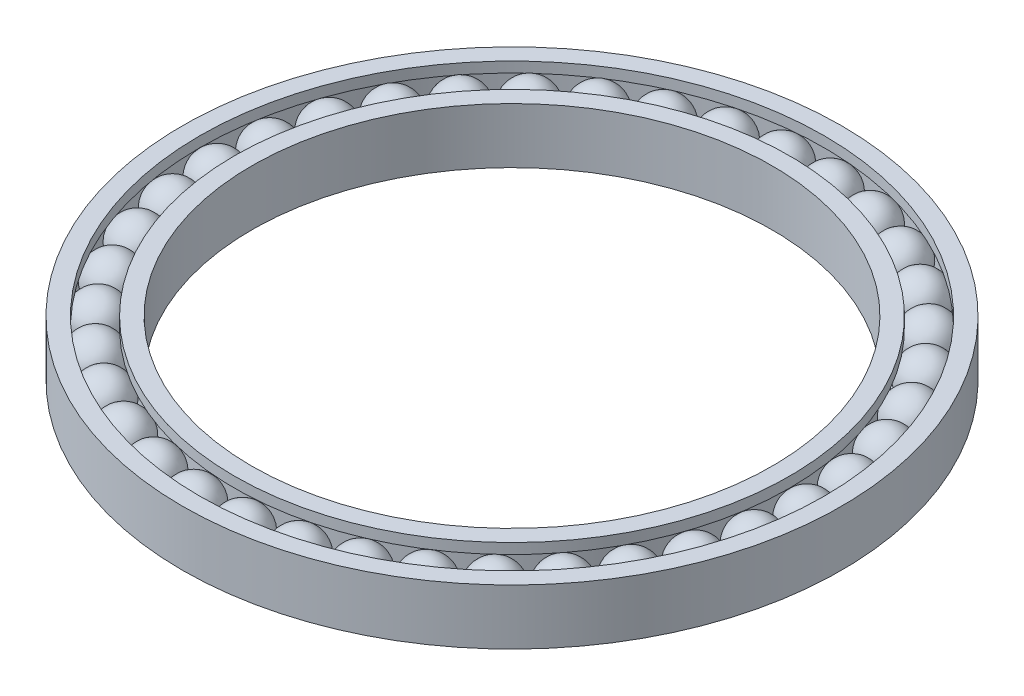
from build123d import *

# Parameters (mm, degrees)
BOSS_EXTRUDE1_START = 3
SKETCH2_R           = 47.5
SKETCH2_R_2         = 45
BOSS_EXTRUDE1_DEPTH = 8
BOSS_EXTRUDE2_START = 3
SKETCH5_R           = 40
SKETCH5_R_2         = 37.5
BOSS_EXTRUDE2_DEPTH = 8
SKETCH3_W           = 7.5
SKETCH3_H           = 5
CIRPATTERN4_COUNT   = 38


with BuildPart() as part:
    # Sketch2 → Boss-Extrude1 (new body)
    with BuildSketch(Plane(origin=(0, 0, 0), x_dir=(1, 0, 0), z_dir=(0, 1, 0)).offset(BOSS_EXTRUDE1_START)):
        with Locations(Location((0, 0, 0), (0, 0, 270))):
            Circle(SKETCH2_R)
        with Locations(Location((0, 0, 0), (0, 0, 270))):
            Circle(SKETCH2_R_2, mode=Mode.SUBTRACT)
    extrude(amount=BOSS_EXTRUDE1_DEPTH)


with BuildPart() as body_2:
    # Sketch5 → Boss-Extrude2 (new body)
    with BuildSketch(Plane(origin=(0, 0, 0), x_dir=(1, 0, 0), z_dir=(0, 1, 0)).offset(BOSS_EXTRUDE2_START)):
        with Locations(Location((0, 0, 0), (0, 0, 270))):
            Circle(SKETCH5_R)
        with Locations(Location((0, 0, 0), (0, 0, 270))):
            Circle(SKETCH5_R_2, mode=Mode.SUBTRACT)
    extrude(amount=BOSS_EXTRUDE2_DEPTH)


with BuildPart() as cut_revolve1_tool:
    # Sketch3 → Cut-Revolve1 (revolve)
    with BuildSketch(Plane.XY):
        with Locations((-42.5, 7)):
            Rectangle(SKETCH3_W, SKETCH3_H)
    revolve(axis=Axis((0, 10.5, 0), (0, -1, 0)))


with BuildPart() as part_1:
    add(part.part)

    # Cut-Revolve1: cut by cut_revolve1_tool
    add(cut_revolve1_tool.part, mode=Mode.SUBTRACT)


with BuildPart() as body_2_1:
    add(body_2.part)

    # Cut-Revolve1: cut by cut_revolve1_tool
    add(cut_revolve1_tool.part, mode=Mode.SUBTRACT)


with BuildPart() as body_3:
    # Sketch6 → Revolve4 (revolve)
    with BuildSketch(Plane.XY):
        with BuildLine():
            Line((42.501734092, 10.521168408), (42.501734092, 8.449571979))
            Line((42.501734092, 8.449571979), (42.501734092, 7.021168408))
            Line((42.501734092, 7.021168408), (42.501734092, 3.521168408))
            ThreePointArc((42.501734092, 3.521168408), (46.001734092, 7.021168408), (42.501734092, 10.521168408))
        make_face()
    revolve(axis=Axis((42.501734092, 11, 0), (0, -1, 0)))


with BuildPart() as cirpattern4_1:
    # CirPattern4: pattern copy
    add(body_3.part.rotate(Axis((0, 0, 0), (0, 1, 0)), 1 * 360 / CIRPATTERN4_COUNT))


with BuildPart() as cirpattern4_2:
    # CirPattern4: pattern copy
    add(body_3.part.rotate(Axis((0, 0, 0), (0, 1, 0)), 2 * 360 / CIRPATTERN4_COUNT))


with BuildPart() as cirpattern4_3:
    # CirPattern4: pattern copy
    add(body_3.part.rotate(Axis((0, 0, 0), (0, 1, 0)), 3 * 360 / CIRPATTERN4_COUNT))


with BuildPart() as cirpattern4_4:
    # CirPattern4: pattern copy
    add(body_3.part.rotate(Axis((0, 0, 0), (0, 1, 0)), 4 * 360 / CIRPATTERN4_COUNT))


with BuildPart() as cirpattern4_5:
    # CirPattern4: pattern copy
    add(body_3.part.rotate(Axis((0, 0, 0), (0, 1, 0)), 5 * 360 / CIRPATTERN4_COUNT))


with BuildPart() as cirpattern4_6:
    # CirPattern4: pattern copy
    add(body_3.part.rotate(Axis((0, 0, 0), (0, 1, 0)), 6 * 360 / CIRPATTERN4_COUNT))


with BuildPart() as cirpattern4_7:
    # CirPattern4: pattern copy
    add(body_3.part.rotate(Axis((0, 0, 0), (0, 1, 0)), 7 * 360 / CIRPATTERN4_COUNT))


with BuildPart() as cirpattern4_8:
    # CirPattern4: pattern copy
    add(body_3.part.rotate(Axis((0, 0, 0), (0, 1, 0)), 8 * 360 / CIRPATTERN4_COUNT))


with BuildPart() as cirpattern4_9:
    # CirPattern4: pattern copy
    add(body_3.part.rotate(Axis((0, 0, 0), (0, 1, 0)), 9 * 360 / CIRPATTERN4_COUNT))


with BuildPart() as cirpattern4_10:
    # CirPattern4: pattern copy
    add(body_3.part.rotate(Axis((0, 0, 0), (0, 1, 0)), 10 * 360 / CIRPATTERN4_COUNT))


with BuildPart() as cirpattern4_11:
    # CirPattern4: pattern copy
    add(body_3.part.rotate(Axis((0, 0, 0), (0, 1, 0)), 11 * 360 / CIRPATTERN4_COUNT))


with BuildPart() as cirpattern4_12:
    # CirPattern4: pattern copy
    add(body_3.part.rotate(Axis((0, 0, 0), (0, 1, 0)), 12 * 360 / CIRPATTERN4_COUNT))


with BuildPart() as cirpattern4_13:
    # CirPattern4: pattern copy
    add(body_3.part.rotate(Axis((0, 0, 0), (0, 1, 0)), 13 * 360 / CIRPATTERN4_COUNT))


with BuildPart() as cirpattern4_14:
    # CirPattern4: pattern copy
    add(body_3.part.rotate(Axis((0, 0, 0), (0, 1, 0)), 14 * 360 / CIRPATTERN4_COUNT))


with BuildPart() as cirpattern4_15:
    # CirPattern4: pattern copy
    add(body_3.part.rotate(Axis((0, 0, 0), (0, 1, 0)), 15 * 360 / CIRPATTERN4_COUNT))


with BuildPart() as cirpattern4_16:
    # CirPattern4: pattern copy
    add(body_3.part.rotate(Axis((0, 0, 0), (0, 1, 0)), 16 * 360 / CIRPATTERN4_COUNT))


with BuildPart() as cirpattern4_17:
    # CirPattern4: pattern copy
    add(body_3.part.rotate(Axis((0, 0, 0), (0, 1, 0)), 17 * 360 / CIRPATTERN4_COUNT))


with BuildPart() as cirpattern4_18:
    # CirPattern4: pattern copy
    add(body_3.part.rotate(Axis((0, 0, 0), (0, 1, 0)), 18 * 360 / CIRPATTERN4_COUNT))


with BuildPart() as cirpattern4_19:
    # CirPattern4: pattern copy
    add(body_3.part.rotate(Axis((0, 0, 0), (0, 1, 0)), 19 * 360 / CIRPATTERN4_COUNT))


with BuildPart() as cirpattern4_20:
    # CirPattern4: pattern copy
    add(body_3.part.rotate(Axis((0, 0, 0), (0, 1, 0)), 20 * 360 / CIRPATTERN4_COUNT))


with BuildPart() as cirpattern4_21:
    # CirPattern4: pattern copy
    add(body_3.part.rotate(Axis((0, 0, 0), (0, 1, 0)), 21 * 360 / CIRPATTERN4_COUNT))


with BuildPart() as cirpattern4_22:
    # CirPattern4: pattern copy
    add(body_3.part.rotate(Axis((0, 0, 0), (0, 1, 0)), 22 * 360 / CIRPATTERN4_COUNT))


with BuildPart() as cirpattern4_23:
    # CirPattern4: pattern copy
    add(body_3.part.rotate(Axis((0, 0, 0), (0, 1, 0)), 23 * 360 / CIRPATTERN4_COUNT))


with BuildPart() as cirpattern4_24:
    # CirPattern4: pattern copy
    add(body_3.part.rotate(Axis((0, 0, 0), (0, 1, 0)), 24 * 360 / CIRPATTERN4_COUNT))


with BuildPart() as cirpattern4_25:
    # CirPattern4: pattern copy
    add(body_3.part.rotate(Axis((0, 0, 0), (0, 1, 0)), 25 * 360 / CIRPATTERN4_COUNT))


with BuildPart() as cirpattern4_26:
    # CirPattern4: pattern copy
    add(body_3.part.rotate(Axis((0, 0, 0), (0, 1, 0)), 26 * 360 / CIRPATTERN4_COUNT))


with BuildPart() as cirpattern4_27:
    # CirPattern4: pattern copy
    add(body_3.part.rotate(Axis((0, 0, 0), (0, 1, 0)), 27 * 360 / CIRPATTERN4_COUNT))


with BuildPart() as cirpattern4_28:
    # CirPattern4: pattern copy
    add(body_3.part.rotate(Axis((0, 0, 0), (0, 1, 0)), 28 * 360 / CIRPATTERN4_COUNT))


with BuildPart() as cirpattern4_29:
    # CirPattern4: pattern copy
    add(body_3.part.rotate(Axis((0, 0, 0), (0, 1, 0)), 29 * 360 / CIRPATTERN4_COUNT))


with BuildPart() as cirpattern4_30:
    # CirPattern4: pattern copy
    add(body_3.part.rotate(Axis((0, 0, 0), (0, 1, 0)), 30 * 360 / CIRPATTERN4_COUNT))


with BuildPart() as cirpattern4_31:
    # CirPattern4: pattern copy
    add(body_3.part.rotate(Axis((0, 0, 0), (0, 1, 0)), 31 * 360 / CIRPATTERN4_COUNT))


with BuildPart() as cirpattern4_32:
    # CirPattern4: pattern copy
    add(body_3.part.rotate(Axis((0, 0, 0), (0, 1, 0)), 32 * 360 / CIRPATTERN4_COUNT))


with BuildPart() as cirpattern4_33:
    # CirPattern4: pattern copy
    add(body_3.part.rotate(Axis((0, 0, 0), (0, 1, 0)), 33 * 360 / CIRPATTERN4_COUNT))


with BuildPart() as cirpattern4_34:
    # CirPattern4: pattern copy
    add(body_3.part.rotate(Axis((0, 0, 0), (0, 1, 0)), 34 * 360 / CIRPATTERN4_COUNT))


with BuildPart() as cirpattern4_35:
    # CirPattern4: pattern copy
    add(body_3.part.rotate(Axis((0, 0, 0), (0, 1, 0)), 35 * 360 / CIRPATTERN4_COUNT))


with BuildPart() as cirpattern4_36:
    # CirPattern4: pattern copy
    add(body_3.part.rotate(Axis((0, 0, 0), (0, 1, 0)), 36 * 360 / CIRPATTERN4_COUNT))


with BuildPart() as cirpattern4_37:
    # CirPattern4: pattern copy
    add(body_3.part.rotate(Axis((0, 0, 0), (0, 1, 0)), 37 * 360 / CIRPATTERN4_COUNT))


solid = Compound([part_1.part, body_2_1.part, body_3.part, cirpattern4_1.part, cirpattern4_2.part, cirpattern4_3.part, cirpattern4_4.part, cirpattern4_5.part, cirpattern4_6.part, cirpattern4_7.part, cirpattern4_8.part, cirpattern4_9.part, cirpattern4_10.part, cirpattern4_11.part, cirpattern4_12.part, cirpattern4_13.part, cirpattern4_14.part, cirpattern4_15.part, cirpattern4_16.part, cirpattern4_17.part, cirpattern4_18.part, cirpattern4_19.part, cirpattern4_20.part, cirpattern4_21.part, cirpattern4_22.part, cirpattern4_23.part, cirpattern4_24.part, cirpattern4_25.part, cirpattern4_26.part, cirpattern4_27.part, cirpattern4_28.part, cirpattern4_29.part, cirpattern4_30.part, cirpattern4_31.part, cirpattern4_32.part, cirpattern4_33.part, cirpattern4_34.part, cirpattern4_35.part, cirpattern4_36.part, cirpattern4_37.part])
